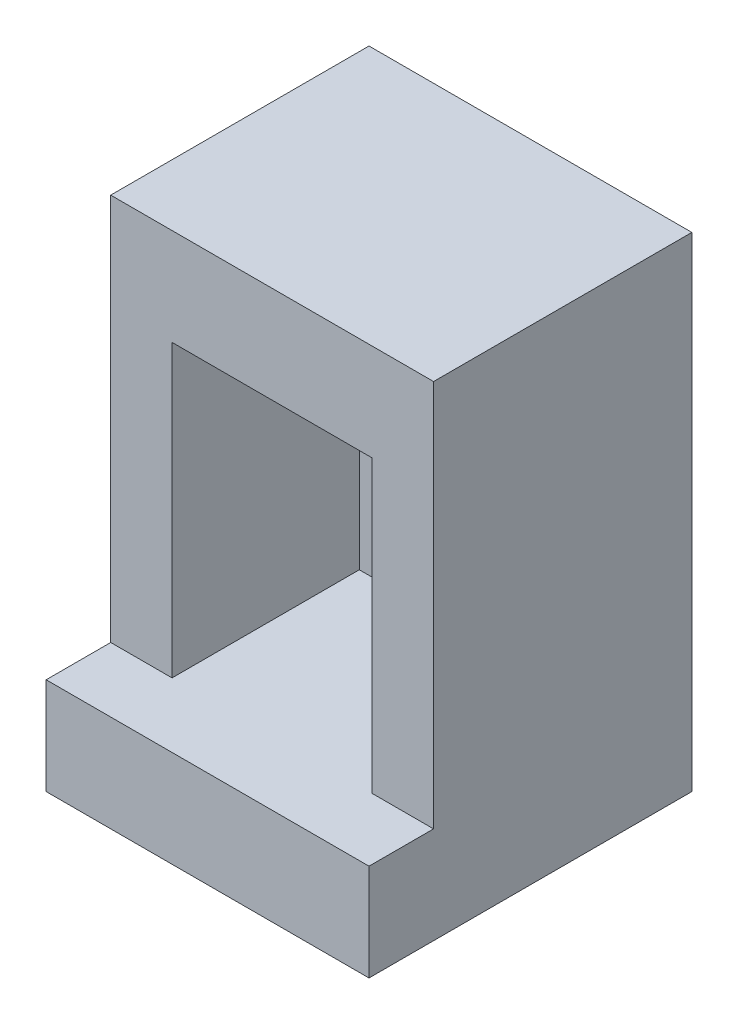
from build123d import *

# Parameters (mm, degrees)
SKETCH1_W           = 10
SKETCH1_H           = 10
BOSS_EXTRUDE1_DEPTH = 3
SKETCH2_W           = 10
SKETCH2_H           = 8
BOSS_EXTRUDE2_DEPTH = 12
SKETCH3_W           = 6.2
SKETCH3_H           = 9
CUT_EXTRUDE1_DEPTH  = 5.8
SKETCH4_R           = 0.75
CUT_EXTRUDE2_DEPTH  = 20.64281039


with BuildPart() as part:
    # Sketch1 → Boss-Extrude1 (new body)
    with BuildSketch(Plane(origin=(0, 0, 0), x_dir=(1, 0, 0), z_dir=(0, 1, 0))):
        with Locations((5, 5)):
            Rectangle(SKETCH1_W, SKETCH1_H)
    extrude(amount=BOSS_EXTRUDE1_DEPTH)

    # Sketch2 → Boss-Extrude2 (add)
    with BuildSketch(Plane(origin=(0, 3, 0), x_dir=(1, 0, 0), z_dir=(0, 1, 0))):
        with Locations((5, 6)):
            Rectangle(SKETCH2_W, SKETCH2_H)
    extrude(amount=BOSS_EXTRUDE2_DEPTH)

    # Sketch3 → Cut-Extrude1 (cut)
    with BuildSketch(Plane.XY.offset(-2)):
        with Locations((5, 7.5)):
            Rectangle(SKETCH3_W, SKETCH3_H)
    extrude(amount=-CUT_EXTRUDE1_DEPTH, mode=Mode.SUBTRACT)

    # Sketch4 → Cut-Extrude2 (cut, through all)
    with BuildSketch(Plane.XY.offset(-7.8)):
        with Locations((5, 9.3)):
            Circle(SKETCH4_R)
    extrude(amount=-CUT_EXTRUDE2_DEPTH, mode=Mode.SUBTRACT)


solid = part.part
